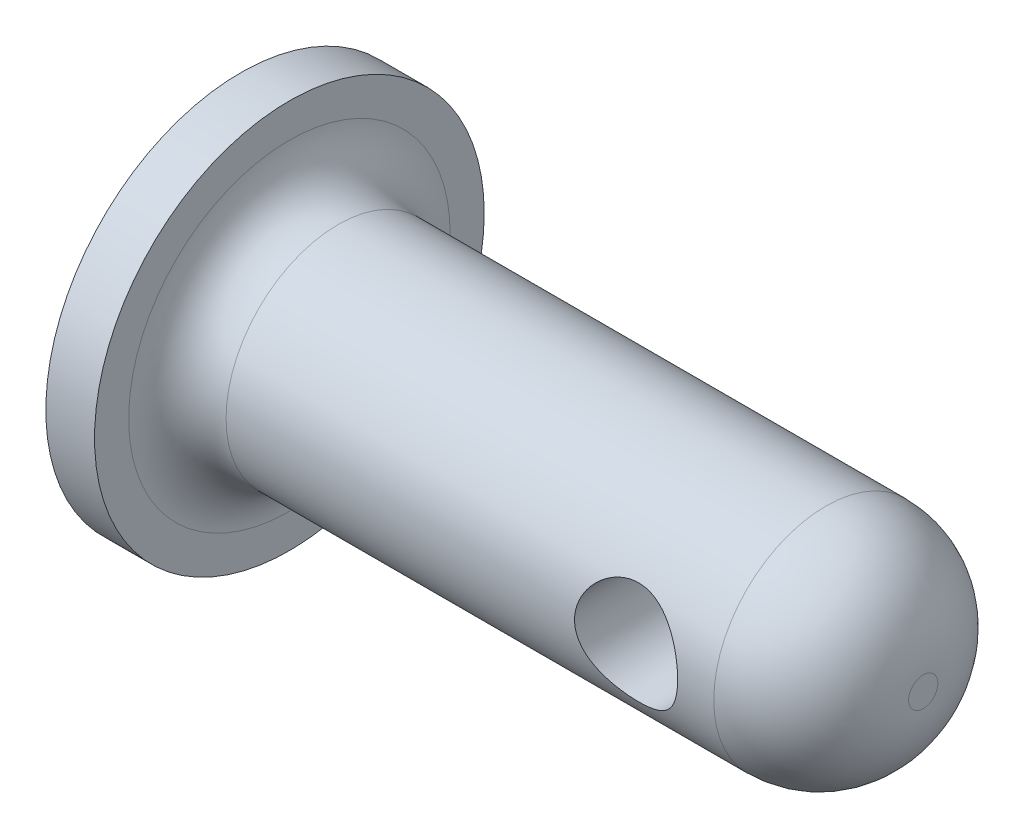
from build123d import *

# Parameters (mm, degrees)
SKETCH2_R           = 20
BOSS_EXTRUDE1_DEPTH = 5
SKETCH3_R           = 11.5
BOSS_EXTRUDE2_DEPTH = 65.062198088
FILLET3_R           = 10
FILLET5_R           = 5
SKETCH6_R           = 5.292916783
CUT_EXTRUDE1_DEPTH  = 85.504906147


with BuildPart() as part:
    # Sketch2 → Boss-Extrude1 (new body)
    with BuildSketch(Plane(origin=(0, 0, 0), x_dir=(0, 0, -1), z_dir=(1, 0, 0))):
        Circle(SKETCH2_R)
    extrude(amount=BOSS_EXTRUDE1_DEPTH)

    # Sketch3 → Boss-Extrude2 (add)
    with BuildSketch(Plane(origin=(5, 0, 0), x_dir=(0, 0, -1), z_dir=(1, 0, 0))):
        Circle(SKETCH3_R)
    extrude(amount=BOSS_EXTRUDE2_DEPTH)

    # Fillet3
    fillet3_edges = [part.edges().sort_by_distance(p)[0] for p in [
        (70.062198088, 0, 11.5),
    ]]
    fillet(fillet3_edges, radius=FILLET3_R)

    # Fillet5
    fillet5_edges = [part.edges().sort_by_distance(p)[0] for p in [
        (5, 0, 11.5),
    ]]
    fillet(fillet5_edges, radius=FILLET5_R)

    # Sketch6 → Cut-Extrude1 (cut, through all)
    with BuildSketch(Plane.XY.offset(22.806162663)):
        with Locations((51.062198088, 0)):
            Circle(SKETCH6_R)
    extrude(amount=-CUT_EXTRUDE1_DEPTH, mode=Mode.SUBTRACT)


solid = part.part
